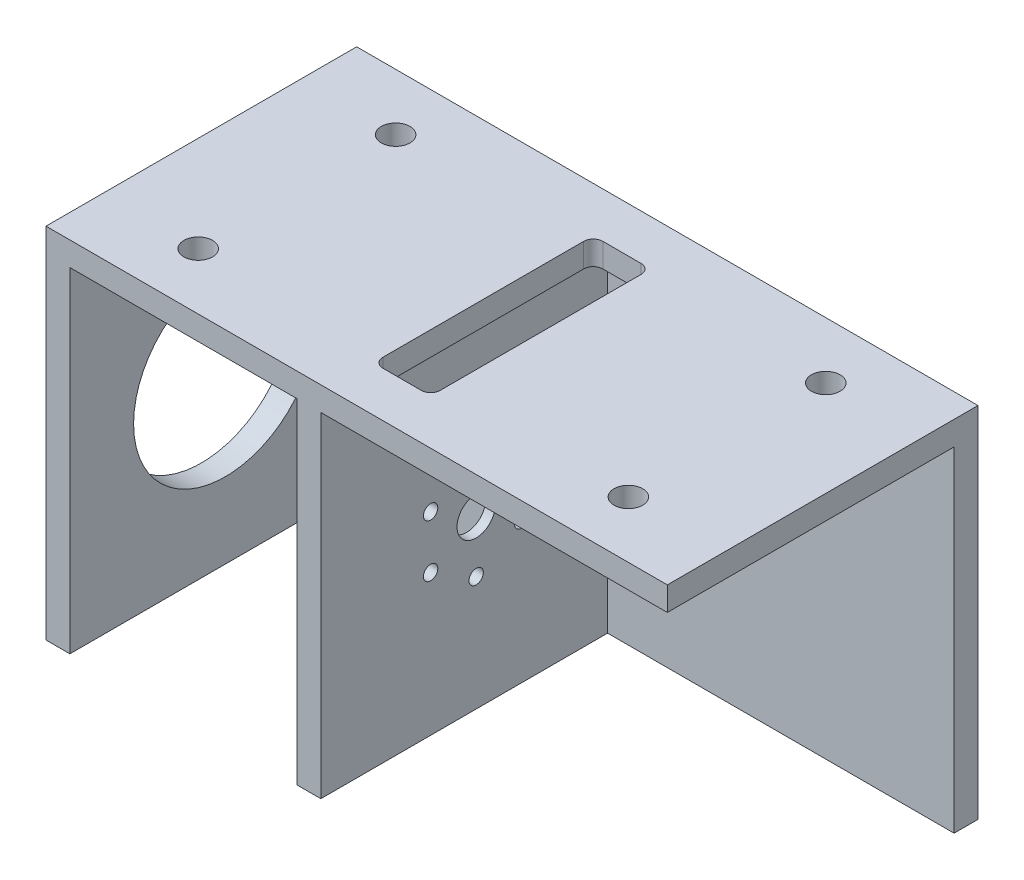
from build123d import *

# Parameters (mm, degrees)
SKETCH1_W           = 130
SKETCH1_H           = 65
SKETCH1_R           = 3
SKETCH1_W_2         = 12
SKETCH1_H_2         = 46
BOSS_EXTRUDE1_DEPTH = 5
FILLET1_R           = 2
SKETCH2_W           = 130
SKETCH2_H           = 5
BOSS_EXTRUDE2_DEPTH = 70
SKETCH3_W           = 5
SKETCH3_H           = 70
BOSS_EXTRUDE3_DEPTH = 60
SKETCH4_R           = 4
SKETCH4_R_2         = 1.5
CUT_EXTRUDE1_DEPTH  = 10
SKETCH5_R           = 8.5
CUT_EXTRUDE2_DEPTH  = 3
SKETCH6_W           = 5
SKETCH6_H           = 70
BOSS_EXTRUDE4_DEPTH = 60
SKETCH7_R           = 19.175
CUT_EXTRUDE3_DEPTH  = 5


with BuildPart() as part:
    # Sketch1 → Boss-Extrude1 (new body)
    with BuildSketch(Plane(origin=(0, 0, 0), x_dir=(1, 0, 0), z_dir=(0, 1, 0))):
        Rectangle(SKETCH1_W, SKETCH1_H)
        with Locations(Location((-45, 20.65, 0), (0, 0, 270))):
            Circle(SKETCH1_R, mode=Mode.SUBTRACT)
        with Locations(Location((-45, -20.65, 0), (0, 0, 90))):
            Circle(SKETCH1_R, mode=Mode.SUBTRACT)
        with Locations(Location((45, 20.65, 0), (0, 0, 90))):
            Circle(SKETCH1_R, mode=Mode.SUBTRACT)
        with Locations(Location((45, -20.65, 0), (0, 0, 270))):
            Circle(SKETCH1_R, mode=Mode.SUBTRACT)
        Rectangle(SKETCH1_W_2, SKETCH1_H_2, mode=Mode.SUBTRACT)
    extrude(amount=BOSS_EXTRUDE1_DEPTH)

    # Fillet1
    fillet1_edges = [part.edges().sort_by_distance(p)[0] for p in [
        (-6, 2.5, -23),
        (-6, 2.5, 23),
        (6, 2.5, 23),
        (6, 2.5, -23),
    ]]
    fillet(fillet1_edges, radius=FILLET1_R)

    # Sketch2 → Boss-Extrude2 (add)
    with BuildSketch(Plane.XZ):
        with Locations((0, -30)):
            Rectangle(SKETCH2_W, SKETCH2_H)
    extrude(amount=BOSS_EXTRUDE2_DEPTH)

    # Sketch3 → Boss-Extrude3 (add)
    with BuildSketch(Plane.XY.offset(-27.5)):
        with Locations((-10, -35)):
            Rectangle(SKETCH3_W, SKETCH3_H)
    extrude(amount=BOSS_EXTRUDE3_DEPTH)

    # Sketch4 → Cut-Extrude1 (cut)
    with BuildSketch(Plane.ZY.offset(12.5)):
        with Locations((0, -35)):
            Circle(SKETCH4_R)
        with Locations((0, -24)):
            Circle(SKETCH4_R_2)
        with Locations((-9.526279442, -29.5)):
            Circle(SKETCH4_R_2)
        with Locations((-9.526279442, -40.5)):
            Circle(SKETCH4_R_2)
        with Locations((0, -46)):
            Circle(SKETCH4_R_2)
        with Locations((9.526279442, -40.5)):
            Circle(SKETCH4_R_2)
        with Locations((9.526279442, -29.5)):
            Circle(SKETCH4_R_2)
    extrude(amount=-CUT_EXTRUDE1_DEPTH, mode=Mode.SUBTRACT)

    # Sketch5 → Cut-Extrude2 (cut)
    with BuildSketch(Plane.ZY.offset(12.5)):
        with Locations((0, -35)):
            Circle(SKETCH5_R)
    extrude(amount=-CUT_EXTRUDE2_DEPTH, mode=Mode.SUBTRACT)

    # Sketch6 → Boss-Extrude4 (add)
    with BuildSketch(Plane.XY.offset(-27.5)):
        with Locations((-62.5, -35)):
            Rectangle(SKETCH6_W, SKETCH6_H)
    extrude(amount=BOSS_EXTRUDE4_DEPTH)

    # Sketch7 → Cut-Extrude3 (cut)
    with BuildSketch(Plane.ZY.offset(65)):
        with Locations((0, -35)):
            Circle(SKETCH7_R)
    extrude(amount=-CUT_EXTRUDE3_DEPTH, mode=Mode.SUBTRACT)


solid = part.part
